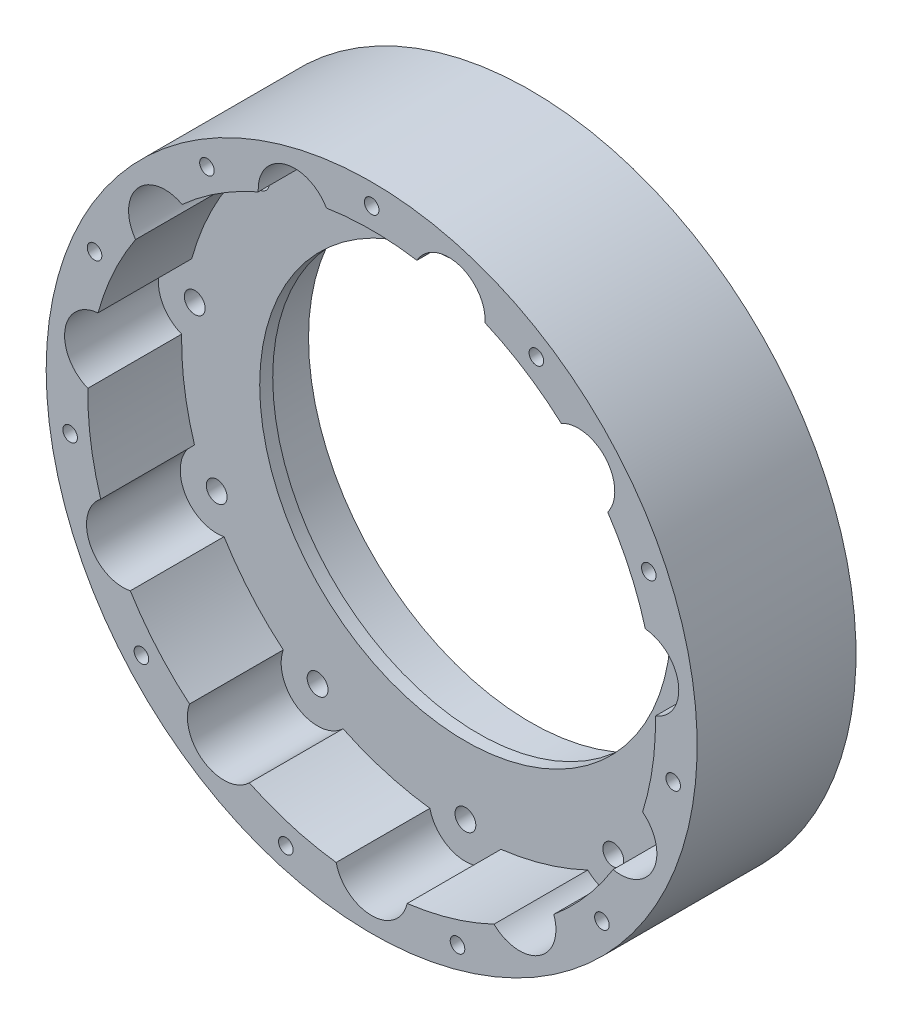
from build123d import *

# Parameters (mm, degrees)
SKETCH_1_R          = 62.5
SKETCH_1_R_2        = 39.5
SKETCH_1_R_3        = 2
SKETCH_1_R_4        = 1.4
EXTRUDE_1_DEPTH     = 30.5
SKETCH_2_R          = 54.5
CUT_EXTRUDE_1_DEPTH = 18
SKETCH_3_R          = 7
CUT_EXTRUDE_2_DEPTH = 18
SKETCH_4_R          = 42.625
CUT_EXTRUDE_3_DEPTH = 10


with BuildPart() as part:
    # 草图1 → 凸台-拉伸1 (new body)
    with BuildSketch(Plane.XY):
        with Locations(Location((0, 0, 0), (0, 0, 180))):
            Circle(SKETCH_1_R)
        with Locations(Location((0, 0, 0), (0, 0, 180))):
            Circle(SKETCH_1_R_2, mode=Mode.SUBTRACT)
        with Locations(Location((0, -52.5, 0), (0, 0, 180))):
            Circle(SKETCH_1_R_3, mode=Mode.SUBTRACT)
        with Locations(Location((-28.383642916, -44.165810474, 0), (0, 0, 180))):
            Circle(SKETCH_1_R_3, mode=Mode.SUBTRACT)
        with Locations(Location((-47.755679756, -21.809288183, 0), (0, 0, 180))):
            Circle(SKETCH_1_R_3, mode=Mode.SUBTRACT)
        with Locations(Location((-51.965625699, 7.471529009, 0), (0, 0, 180))):
            Circle(SKETCH_1_R_3, mode=Mode.SUBTRACT)
        with Locations(Location((-39.676852654, 34.380188532, 0), (0, 0, 180))):
            Circle(SKETCH_1_R_3, mode=Mode.SUBTRACT)
        with Locations(Location((-14.790959234, 50.373381115, 0), (0, 0, 180))):
            Circle(SKETCH_1_R_3, mode=Mode.SUBTRACT)
        with Locations(Location((14.790959234, 50.373381115, 0), (0, 0, 180))):
            Circle(SKETCH_1_R_3, mode=Mode.SUBTRACT)
        with Locations(Location((39.676852654, 34.380188532, 0), (0, 0, 180))):
            Circle(SKETCH_1_R_3, mode=Mode.SUBTRACT)
        with Locations(Location((51.965625699, 7.471529009, 0), (0, 0, 180))):
            Circle(SKETCH_1_R_3, mode=Mode.SUBTRACT)
        with Locations(Location((47.755679756, -21.809288183, 0), (0, 0, 180))):
            Circle(SKETCH_1_R_3, mode=Mode.SUBTRACT)
        with Locations(Location((28.383642916, -44.165810474, 0), (0, 0, 180))):
            Circle(SKETCH_1_R_3, mode=Mode.SUBTRACT)
        with Locations(Location((-31.625977228, 49.210981142, 0), (0, 0, 180))):
            Circle(SKETCH_1_R_4, mode=Mode.SUBTRACT)
        with Locations(Location((0, 58.497205922, 0), (0, 0, 180))):
            Circle(SKETCH_1_R_4, mode=Mode.SUBTRACT)
        with Locations(Location((31.625977228, 49.210981142, 0), (0, 0, 180))):
            Circle(SKETCH_1_R_4, mode=Mode.SUBTRACT)
        with Locations(Location((53.210930145, 24.300617558, 0), (0, 0, 180))):
            Circle(SKETCH_1_R_4, mode=Mode.SUBTRACT)
        with Locations(Location((57.901788711, -8.3250204, 0), (0, 0, 180))):
            Circle(SKETCH_1_R_4, mode=Mode.SUBTRACT)
        with Locations(Location((44.209238476, -38.307523204, 0), (0, 0, 180))):
            Circle(SKETCH_1_R_4, mode=Mode.SUBTRACT)
        with Locations(Location((16.480567392, -56.127658058, 0), (0, 0, 180))):
            Circle(SKETCH_1_R_4, mode=Mode.SUBTRACT)
        with Locations(Location((-16.480567392, -56.127658058, 0), (0, 0, 180))):
            Circle(SKETCH_1_R_4, mode=Mode.SUBTRACT)
        with Locations(Location((-44.209238476, -38.307523204, 0), (0, 0, 180))):
            Circle(SKETCH_1_R_4, mode=Mode.SUBTRACT)
        with Locations(Location((-57.901788711, -8.3250204, 0), (0, 0, 180))):
            Circle(SKETCH_1_R_4, mode=Mode.SUBTRACT)
        with Locations(Location((-53.210930145, 24.300617558, 0), (0, 0, 180))):
            Circle(SKETCH_1_R_4, mode=Mode.SUBTRACT)
    extrude(amount=EXTRUDE_1_DEPTH)

    # 草图2 → 切除-拉伸1 (cut)
    with BuildSketch(Plane.XY.offset(30.5)):
        Circle(SKETCH_2_R)
    extrude(amount=-CUT_EXTRUDE_1_DEPTH, mode=Mode.SUBTRACT)

    # 草图3 → 切除-拉伸2 (cut)
    with BuildSketch(Plane.XY.offset(30.5)):
        with Locations((-39.676852654, 34.380188532)):
            Circle(SKETCH_3_R)
        with Locations((-14.790959234, 50.373381115)):
            Circle(SKETCH_3_R)
        with Locations((14.790959234, 50.373381115)):
            Circle(SKETCH_3_R)
        with Locations((39.676852654, 34.380188532)):
            Circle(SKETCH_3_R)
        with Locations((51.965625699, 7.471529009)):
            Circle(SKETCH_3_R)
        with Locations((47.755679756, -21.809288183)):
            Circle(SKETCH_3_R)
        with Locations((28.383642916, -44.165810474)):
            Circle(SKETCH_3_R)
        with Locations((0, -52.5)):
            Circle(SKETCH_3_R)
        with Locations((-28.383642916, -44.165810474)):
            Circle(SKETCH_3_R)
        with Locations((-47.755679756, -21.809288183)):
            Circle(SKETCH_3_R)
        with Locations((-51.965625699, 7.471529009)):
            Circle(SKETCH_3_R)
    extrude(amount=-CUT_EXTRUDE_2_DEPTH, mode=Mode.SUBTRACT)

    # 草图4 → 切除-拉伸3 (cut)
    with BuildSketch(Plane(origin=(0, 0, 0), x_dir=(-1, 0, 0), z_dir=(0, 0, -1))):
        Circle(SKETCH_4_R)
    extrude(amount=-CUT_EXTRUDE_3_DEPTH, mode=Mode.SUBTRACT)


solid = part.part
